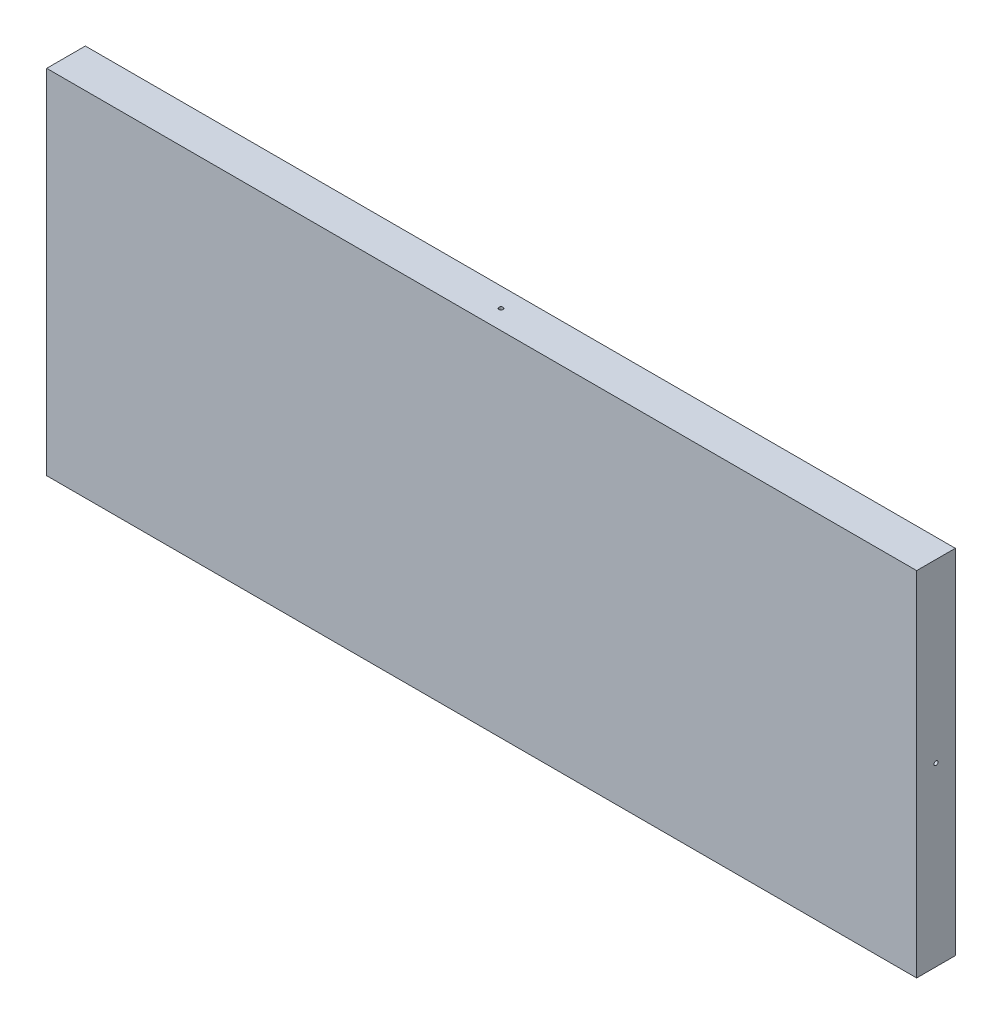
from build123d import *

# Parameters (mm, degrees)
SKETCH_1_W         = 900
SKETCH_1_H         = 365
EXTRUDE_1_DEPTH    = 40
HOLE_WIZARD_M5_1_D = 4.2
HOLE_WIZARD_M5_2_D = 4.2


with BuildPart() as part:
    # 草图1 → 凸台-拉伸1 (new body)
    with BuildSketch(Plane.XY):
        Rectangle(SKETCH_1_W, SKETCH_1_H)
    extrude(amount=EXTRUDE_1_DEPTH)

    # M5 螺纹孔1 (through all)
    with Locations(Plane(origin=(0, 182.5, 0), x_dir=(1, 0, 0), z_dir=(0, 1, 0))):
        with Locations((0, -20)):
            Hole(HOLE_WIZARD_M5_1_D / 2)

    # M5 螺纹孔2 (through all)
    with Locations(Plane.ZY.offset(450)):
        with Locations((20, 0)):
            Hole(HOLE_WIZARD_M5_2_D / 2)


solid = part.part
